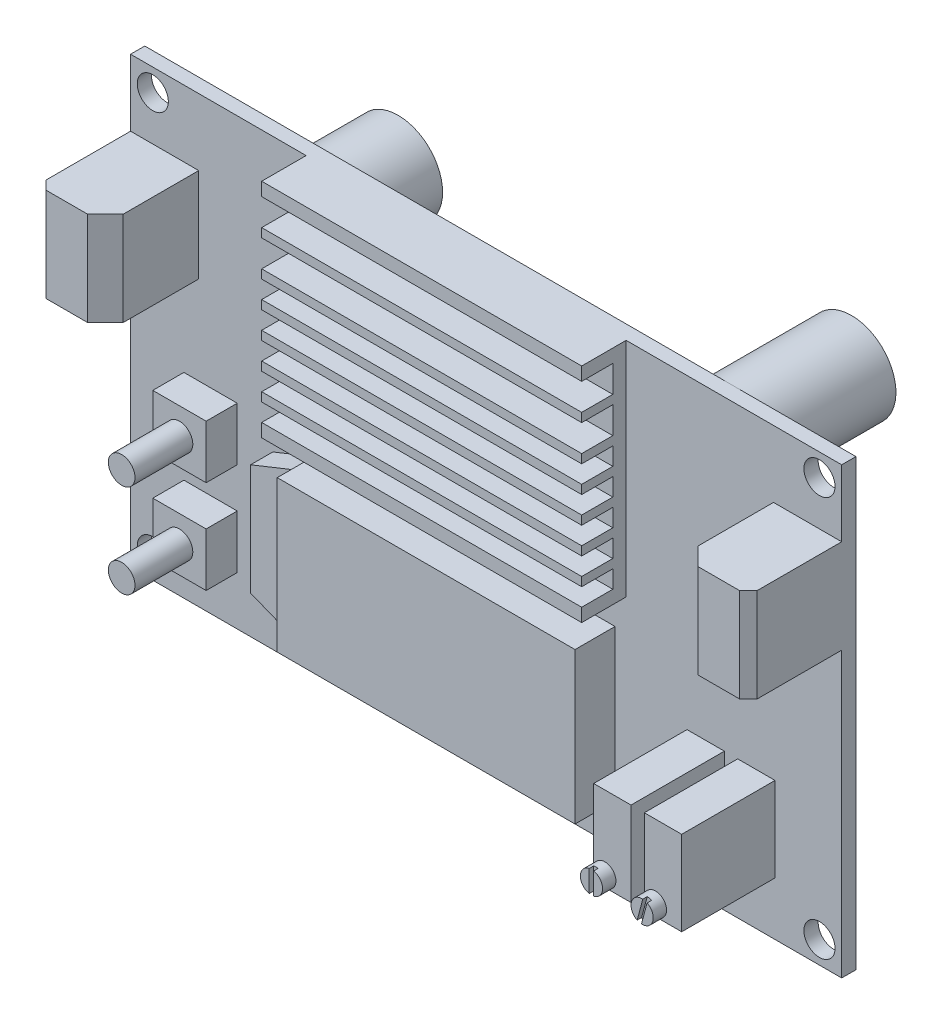
from build123d import *

# Parameters (mm, degrees)
SKETCH1_W            = 80
SKETCH1_H            = 50
SKETCH1_R            = 1.75
BOSS_EXTRUDE1_DEPTH  = 1.6
SKETCH2_W            = 4.2
SKETCH2_H            = 9.5
SKETCH2_W_2          = 7.67
SKETCH2_H_2          = 10.56
BOSS_EXTRUDE2_DEPTH  = 10.5
CHAMFER1_SIZE        = 2
CHAMFER2_SIZE        = 1
SKETCH3_R            = 1.25
BOSS_EXTRUDE3_DEPTH  = 1.5
CUT_EXTRUDE1_START   = -0.5
CUT_EXTRUDE1_DEPTH   = 0.5
SKETCH5_W            = 33.5
SKETCH5_H            = 17
BOSS_EXTRUDE4_DEPTH  = 4.5
BOSS_EXTRUDE5_DEPTH  = 2.5
SKETCH7_W            = 6
SKETCH7_H            = 6
BOSS_EXTRUDE6_DEPTH  = 3.5
SKETCH8_R            = 1.5
BOSS_EXTRUDE7_DEPTH  = 6.5
SKETCH9_W            = 36
SKETCH9_H            = 25
BOSS_EXTRUDE8_DEPTH  = 1.5
SKETCH10_W           = 36
SKETCH10_H           = 1.5
SKETCH10_H_2         = 1
BOSS_EXTRUDE9_DEPTH  = 3.5
SKETCH11_R           = 5
BOSS_EXTRUDE10_DEPTH = 13.5
SKETCH12_R           = 10.25
SKETCH12_R_2         = 6.25
BOSS_EXTRUDE11_DEPTH = 8.25


with BuildPart() as part:
    # Sketch1 → Boss-Extrude1 (new body)
    with BuildSketch(Plane.XY):
        Rectangle(SKETCH1_W, SKETCH1_H)
        with Locations((-37.5, 22.5)):
            Circle(SKETCH1_R, mode=Mode.SUBTRACT)
        with Locations((-37.5, -22.5)):
            Circle(SKETCH1_R, mode=Mode.SUBTRACT)
        with Locations((37.5, -22.5)):
            Circle(SKETCH1_R, mode=Mode.SUBTRACT)
        with Locations((37.5, 22.5)):
            Circle(SKETCH1_R, mode=Mode.SUBTRACT)
    extrude(amount=BOSS_EXTRUDE1_DEPTH)

    # Sketch2 → Boss-Extrude2 (add)
    with BuildSketch(Plane.XY.offset(1.6)):
        with Locations((24.7, -14.25)):
            Rectangle(SKETCH2_W, SKETCH2_H)
        with Locations((30.4, -14.25)):
            Rectangle(SKETCH2_W, SKETCH2_H)
        with Locations((36.165, 12.22)):
            Rectangle(SKETCH2_W_2, SKETCH2_H_2)
        with Locations((-36.165, 12.22)):
            Rectangle(SKETCH2_W_2, SKETCH2_H_2)
    extrude(amount=BOSS_EXTRUDE2_DEPTH)

    # Chamfer1
    chamfer1_edges = [part.edges().sort_by_distance(p)[0] for p in [
        (32.33, 12.22, 12.1),
        (-32.33, 12.22, 12.1),
    ]]
    chamfer(chamfer1_edges, length=CHAMFER1_SIZE)

    # Chamfer2
    chamfer2_edges = [part.edges().sort_by_distance(p)[0] for p in [
        (40, 12.22, 12.1),
        (-40, 12.22, 12.1),
    ]]
    chamfer(chamfer2_edges, length=CHAMFER2_SIZE)

    # Sketch3 → Boss-Extrude3 (add)
    with BuildSketch(Plane.XY.offset(12.1)):
        with Locations(Location((23.85, -17.75, 0), (0, 0, 180))):
            Circle(SKETCH3_R)
        with Locations(Location((29.55, -17.75, 0), (0, 0, 180))):
            Circle(SKETCH3_R)
    extrude(amount=BOSS_EXTRUDE3_DEPTH)

    # Sketch4 → Cut-Extrude1 (cut)
    with BuildSketch(Plane.XY.offset(13.6).offset(CUT_EXTRUDE1_START)):
        with BuildLine():
            Line((23.6, -16.525255129), (23.6, -18.974744871))
            ThreePointArc((23.6, -18.974744871), (23.85, -19), (24.1, -18.974744871))
            Line((24.1, -18.974744871), (24.1, -16.525255129))
            ThreePointArc((24.1, -16.525255129), (23.85, -16.5), (23.6, -16.525255129))
        make_face()
        with BuildLine():
            Line((28.991531245, -18.868307941), (29.625505842, -16.502282537))
            ThreePointArc((29.625505842, -16.502282537), (29.873523806, -16.542592717), (30.108468755, -16.631692059))
            Line((30.108468755, -16.631692059), (29.474494158, -18.997717463))
            ThreePointArc((29.474494158, -18.997717463), (29.226476194, -18.957407283), (28.991531245, -18.868307941))
        make_face()
    extrude(amount=CUT_EXTRUDE1_DEPTH, mode=Mode.SUBTRACT)

    # Sketch5 → Boss-Extrude4 (add)
    with BuildSketch(Plane.XY.offset(1.6)):
        with Locations((-2.25, -12)):
            Rectangle(SKETCH5_W, SKETCH5_H)
    extrude(amount=BOSS_EXTRUDE4_DEPTH)

    # Sketch6 → Boss-Extrude5 (add)
    with BuildSketch(Plane.XY.offset(1.6)):
        Polygon((-24, -18.25), (-19, -20.25), (-19, -3.75), (-24, -5.75), align=None)
    extrude(amount=BOSS_EXTRUDE5_DEPTH)

    # Sketch7 → Boss-Extrude6 (add)
    with BuildSketch(Plane.XY.offset(1.6)):
        with Locations((-31, -16.5)):
            Rectangle(SKETCH7_W, SKETCH7_H)
        with Locations((-31, -6)):
            Rectangle(SKETCH7_W, SKETCH7_H)
    extrude(amount=BOSS_EXTRUDE6_DEPTH)

    # Sketch8 → Boss-Extrude7 (add)
    with BuildSketch(Plane.XY.offset(5.1)):
        with Locations(Location((-31, -6, 0), (0, 0, 180))):
            Circle(SKETCH8_R)
        with Locations(Location((-31, -16.5, 0), (0, 0, 180))):
            Circle(SKETCH8_R)
    extrude(amount=BOSS_EXTRUDE7_DEPTH)

    # Sketch9 → Boss-Extrude8 (add)
    with BuildSketch(Plane.XY.offset(1.6)):
        with Locations((-2.25, 12.5)):
            Rectangle(SKETCH9_W, SKETCH9_H)
    extrude(amount=BOSS_EXTRUDE8_DEPTH)

    # Sketch10 → Boss-Extrude9 (add)
    with BuildSketch(Plane.XY.offset(3.1)):
        with Locations((-2.25, 0.75)):
            Rectangle(SKETCH10_W, SKETCH10_H)
        with Locations((-2.25, 24.25)):
            Rectangle(SKETCH10_W, SKETCH10_H)
        with Locations((-2.25, 3.993100162)):
            Rectangle(SKETCH10_W, SKETCH10_H_2)
        with Locations((-2.25, 6.986200324)):
            Rectangle(SKETCH10_W, SKETCH10_H_2)
        with Locations((-2.25, 9.979300486)):
            Rectangle(SKETCH10_W, SKETCH10_H_2)
        with Locations((-2.25, 12.972400648)):
            Rectangle(SKETCH10_W, SKETCH10_H_2)
        with Locations((-2.25, 15.96550081)):
            Rectangle(SKETCH10_W, SKETCH10_H_2)
        with Locations((-2.25, 19.982750405)):
            Rectangle(SKETCH10_W, SKETCH10_H_2)
    extrude(amount=BOSS_EXTRUDE9_DEPTH)

    # Sketch11 → Boss-Extrude10 (add)
    with BuildSketch(Plane(origin=(0, 0, 0), x_dir=(-1, 0, 0), z_dir=(0, 0, -1))):
        with Locations(Location((-26, 20, 0), (0, 0, 90))):
            Circle(SKETCH11_R)
        with Locations(Location((25, 14, 0), (0, 0, 180))):
            Circle(SKETCH11_R)
    extrude(amount=BOSS_EXTRUDE10_DEPTH)

    # Sketch12 → Boss-Extrude11 (add)
    with BuildSketch(Plane(origin=(0, 0, 0), x_dir=(-1, 0, 0), z_dir=(0, 0, -1))):
        with Locations(Location((-20.5, 4, 0), (0, 0, 180))):
            Circle(SKETCH12_R)
        with Locations((-20.5, 4)):
            Circle(SKETCH12_R_2, mode=Mode.SUBTRACT)
    extrude(amount=BOSS_EXTRUDE11_DEPTH)


solid = part.part
